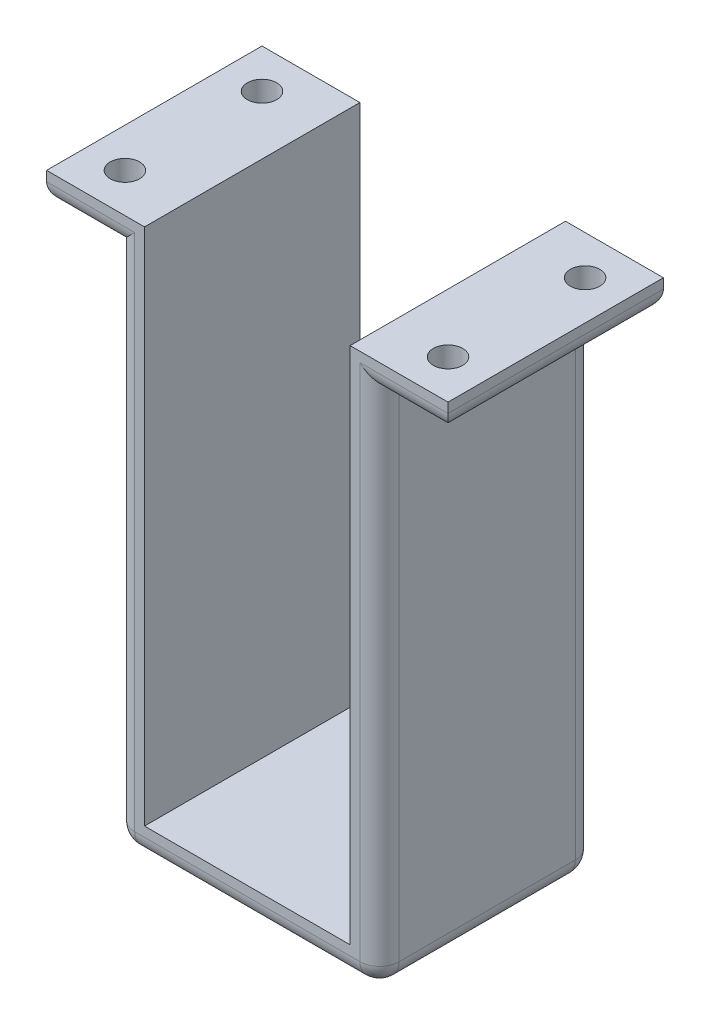
from build123d import *

# Parameters (mm, degrees)
CROQUIS1_W              = 22
CROQUIS1_H              = 50
SALIENTE_EXTRUIR2_DEPTH = 3
CROQUIS2_W              = 27
CROQUIS2_H              = 22
SALIENTE_EXTRUIR3_DEPTH = 3
CROQUIS3_W              = 3
CROQUIS3_H              = 22
SALIENTE_EXTRUIR4_DEPTH = 50
CROQUIS4_W              = 10
CROQUIS4_H              = 22
CROQUIS4_R              = 1.5
SALIENTE_EXTRUIR5_DEPTH = 3
REDONDEO1_R             = 2


with BuildPart() as part:
    # Croquis1 → Saliente-Extruir2 (new body)
    with BuildSketch(Plane(origin=(0, 0, 0), x_dir=(0, 0, -1), z_dir=(1, 0, 0))):
        with Locations((-11, -25)):
            Rectangle(CROQUIS1_W, CROQUIS1_H)
    extrude(amount=SALIENTE_EXTRUIR2_DEPTH)

    # Croquis2 → Saliente-Extruir3 (add)
    with BuildSketch(Plane(origin=(0, -50, 0), x_dir=(-1, 0, 0), z_dir=(0, -1, 0))):
        with Locations((-13.5, -11)):
            Rectangle(CROQUIS2_W, CROQUIS2_H)
    extrude(amount=SALIENTE_EXTRUIR3_DEPTH)

    # Croquis3 → Saliente-Extruir4 (add)
    with BuildSketch(Plane(origin=(0, -50, 0), x_dir=(1, 0, 0), z_dir=(0, 1, 0))):
        with Locations((25.5, -11)):
            Rectangle(CROQUIS3_W, CROQUIS3_H)
    extrude(amount=SALIENTE_EXTRUIR4_DEPTH)

    # Croquis4 → Saliente-Extruir5 (add)
    # profile 1 of 2: a face of its own
    with BuildSketch(Plane(origin=(0, 0, 0), x_dir=(1, 0, 0), z_dir=(0, 1, 0))):
        with Locations((-2, -11)):
            Rectangle(CROQUIS4_W, CROQUIS4_H)
        with Locations(Location((-3, -4, 0), (0, 0, 270))):
            Circle(CROQUIS4_R, mode=Mode.SUBTRACT)
        with Locations(Location((-3, -18, 0), (0, 0, 270))):
            Circle(CROQUIS4_R, mode=Mode.SUBTRACT)
    # profile 2 of 2: a face of its own
    with BuildSketch(Plane(origin=(0, 0, 0), x_dir=(1, 0, 0), z_dir=(0, 1, 0))):
        with Locations((29, -11)):
            Rectangle(CROQUIS4_W, CROQUIS4_H)
        with Locations(Location((30, -18, 0), (0, 0, 270))):
            Circle(CROQUIS4_R, mode=Mode.SUBTRACT)
        with Locations(Location((30, -4, 0), (0, 0, 270))):
            Circle(CROQUIS4_R, mode=Mode.SUBTRACT)
    extrude(amount=SALIENTE_EXTRUIR5_DEPTH)

    # Redondeo1
    redondeo1_edges = [part.edges().sort_by_distance(p)[0] for p in [
        (27, -26.5, 0),
        (27, -26.5, 22),
        (27, -53, 11),
        (13.5, -53, 22),
        (0, -53, 11),
        (13.5, -53, 0),
        (-3.5, 0, 0),
        (-7, 0, 11),
        (-3.5, 0, 22),
        (0, -26.5, 0),
        (0, -26.5, 22),
        (30.5, 0, 22),
        (34, 0, 11),
        (30.5, 0, 0),
    ]]
    fillet(redondeo1_edges, radius=REDONDEO1_R)


solid = part.part
